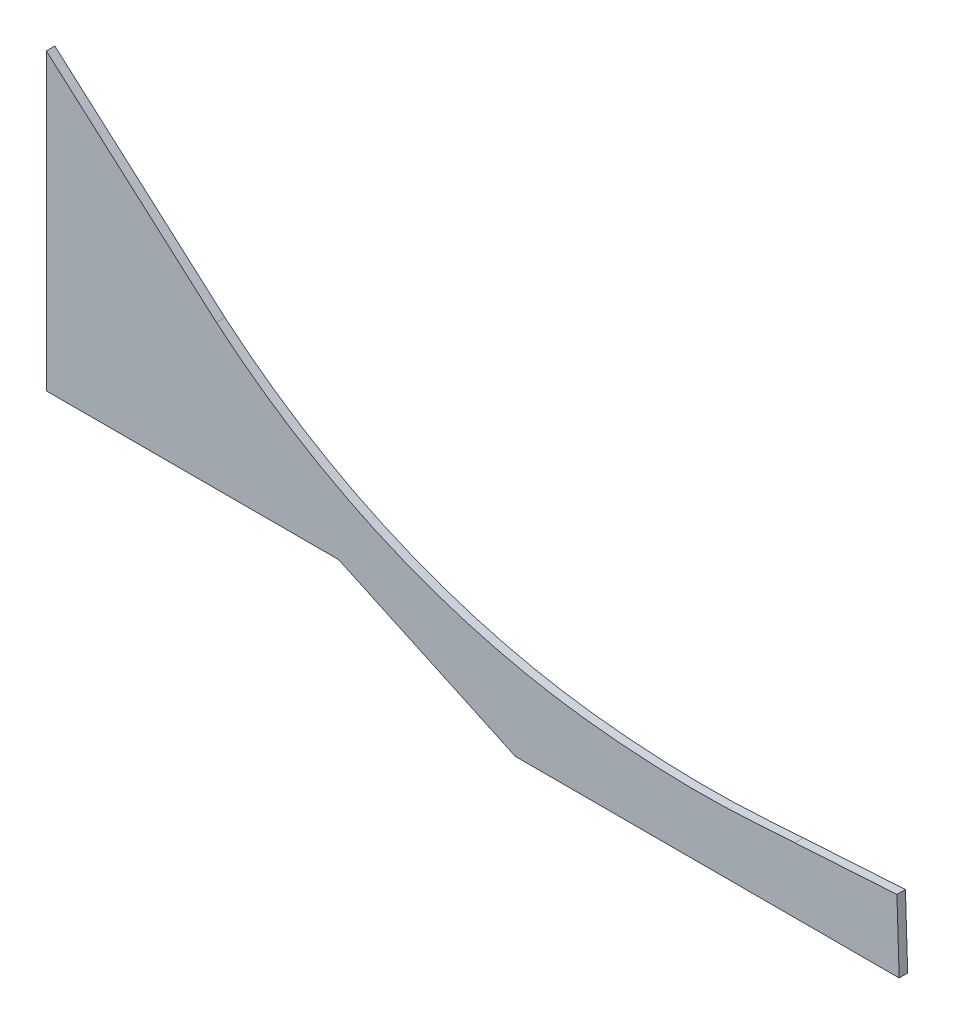
from build123d import *

# Parameters (mm, degrees)
P_IDAT_VYSUNUT_M1_DEPTH = 1


with BuildPart() as part:
    # Skica1 → Přidat vysunutím1 (new body)
    with BuildSketch(Plane.XY):
        with BuildLine():
            Line((-50, 16.966408225), (-70, 34.613472684))
            Line((-70, 34.613472684), (-70, 0))
            Line((-70, 0), (-35.640611214, 0))
            Line((-35.640611214, 0), (-14.855667701, -9.644204288))
            Line((-14.855667701, -9.644204288), (30.264283345, -9.644204288))
            Line((30.264283345, -9.644204288), (30, -1.266639703))
            Line((30, -1.266639703), (18, -2.011136657))
            add(Edge.make_bspline(
                [(-50, 16.966408225), (-43.991226664, 11.871570217), (-34.17756419, 5.795583319), (-20.181640748, 0.787148233), (-10.092446875, -1.45782146), (-0.026309786, -2.456617667), (9.343623235, -2.642712691), (15.33383978, -2.176549004), (18, -2.011136657)],
                knots=[0, 0, 0, 0, 0.325390078, 0.471834546, 0.613059233, 0.751676123, 0.88953762, 1, 1, 1, 1], degree=3))
        make_face()
    extrude(amount=P_IDAT_VYSUNUT_M1_DEPTH)


solid = part.part
